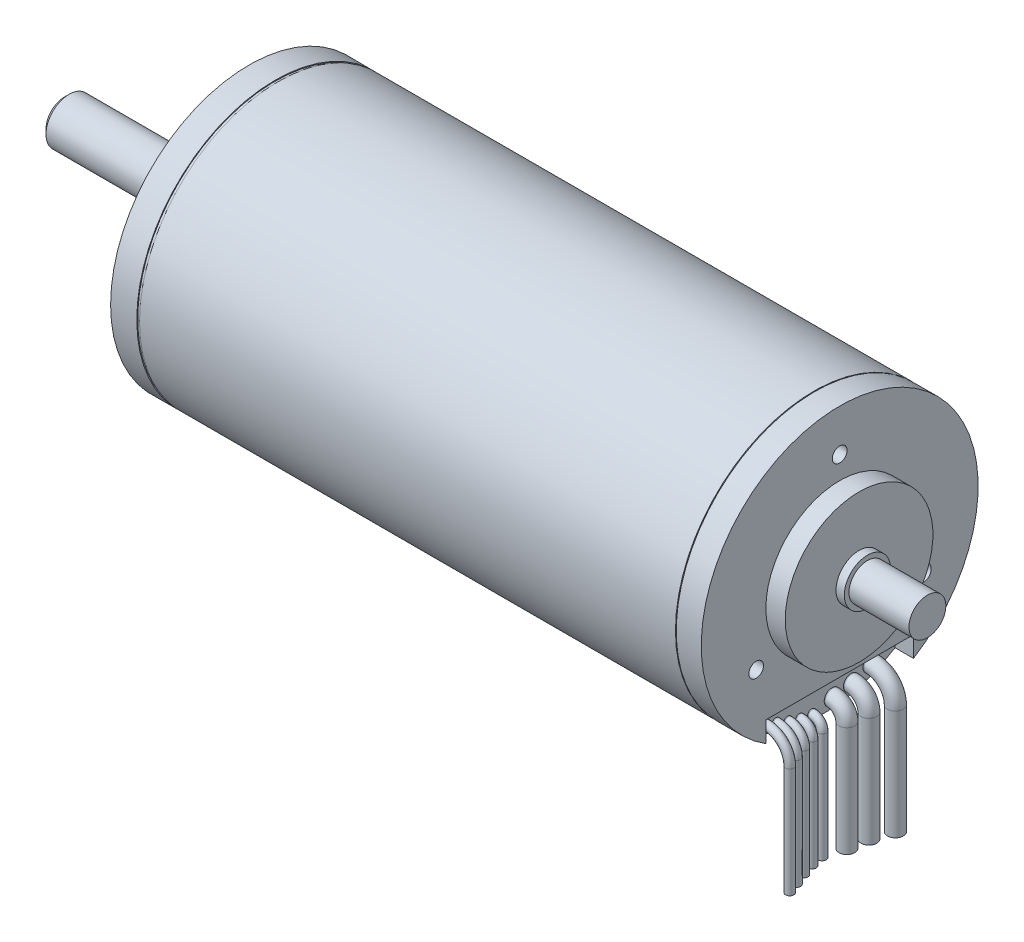
from build123d import *

# Parameters (mm, degrees)
SKETCH_2_R          = 1.5
CUT_EXTRUDE_1_DEPTH = 4.5
SKETCH_3_R          = 0.8
SKETCH_3_R_2        = 0.87
CUT_EXTRUDE_2_DEPTH = 2.4
CUT_EXTRUDE_START   = -2
CUT_EXTRUDE_3_DEPTH = 2
SKETCH_5_R          = 0.848918058
SKETCH_5_R_2        = 0.45
SKETCH_5_R_3        = 0.844950089
SKETCH_5_R_4        = 0.85
CUT_EXTRUDE_START_2 = -5
SKETCH_7_R          = 2
CUT_EXTRUDE_4_DEPTH = 5
SKETCH_8_W          = 0.298438665
SKETCH_8_H          = 0.097633954
SKETCH_9_W          = 0.088601238
SKETCH_9_H          = 0.502687411


with BuildPart() as part:
    # Model → 旋转1 (revolve)
    with BuildSketch(Plane.XY, mode=Mode.PRIVATE) as revolve_1_sk:
        Polygon((20, 7), (18.8, 7), (18.8, 12.5), (0.5, 12.5), (0, 13), (0, 15), (98.5, 15), (98.5, 13), (87, 13), (87, 12.5), (86.1, 12.5), (86.1, 7), (84, 7), (84, 0), (20, 0), align=None)
    revolve(revolve_1_sk.sketch.rotate(Axis((0, 15, 0), (1, 0, 0)), 270), axis=Axis((0, 15, 0), (1, 0, 0)))

    # 草图2 → 切除-拉伸1 (cut)
    with BuildSketch(Plane.ZY.offset(-20)):
        with Locations((0, 26)):
            Circle(SKETCH_2_R)
        with Locations((11, 15)):
            Circle(SKETCH_2_R)
        with Locations((0, 4)):
            Circle(SKETCH_2_R)
        with Locations((-11, 15)):
            Circle(SKETCH_2_R)
    extrude(amount=-CUT_EXTRUDE_1_DEPTH, mode=Mode.SUBTRACT)

    # 草图3 → 切除-拉伸2 (cut)
    with BuildSketch(Plane(origin=(84, 0, 0), x_dir=(0, 0, -1), z_dir=(1, 0, 0))):
        with Locations((0, 25.45)):
            Circle(SKETCH_3_R)
        with Locations((9.04996547, 9.775)):
            Circle(SKETCH_3_R_2)
        with Locations((-9.04996547, 9.775)):
            Circle(SKETCH_3_R)
    extrude(amount=-CUT_EXTRUDE_2_DEPTH, mode=Mode.SUBTRACT)

    # 草图4 → 切除-拉伸3 (cut)
    with BuildSketch(Plane(origin=(84, 0, 0), x_dir=(0, 0, -1), z_dir=(1, 0, 0)).offset(CUT_EXTRUDE_START)):
        with BuildLine():
            Line((0, 4.55), (-8, 4.55))
            Line((-8, 4.55), (-8, 2.31142246))
            ThreePointArc((-8, 2.31142246), (0, 0), (8, 2.31142246))
            Line((8, 2.31142246), (8, 4.55))
            Line((8, 4.55), (0, 4.55))
        make_face()
    extrude(amount=CUT_EXTRUDE_3_DEPTH, mode=Mode.SUBTRACT)

    # 扫描1: sweep along a path in 草图6
    with BuildLine(Plane.XY) as sweep_1_path:
        Line((83.392576521, -12.282126989), (83.392576521, -0.384586773))
        ThreePointArc((83.392576521, -0.384586773), (83.011815336, 0.534652043), (82.092576521, 0.915413227))
        Line((82.092576521, 0.915413227), (82, 0.915413227))
    # 草图5 → 扫描1 (sweep)
    with BuildSketch(Plane(origin=(82, 0, 0), x_dir=(0, 0, -1), z_dir=(1, 0, 0))):
        with Locations((1.173037316, 1.126598722)):
            Circle(SKETCH_5_R)
        with Locations((-6.075437479, 2.186898349)):
            Circle(SKETCH_5_R_2)
        with Locations((3.248517437, 1.442432653)):
            Circle(SKETCH_5_R_3)
        with Locations((5.369116691, 2.186898349)):
            Circle(SKETCH_5_R_4)
        with Locations((-1.037800205, 0.652847824)):
            Circle(SKETCH_5_R_2)
        with Locations((-2.346255063, 0.874404145)):
            Circle(SKETCH_5_R_2)
        with Locations((-3.632150356, 1.261956121)):
            Circle(SKETCH_5_R_2)
        with Locations((-4.918045648, 1.758266585)):
            Circle(SKETCH_5_R_2)
    sweep(path=sweep_1_path.line)

    # 草图7 → 切除-拉伸4 (cut)
    with BuildSketch(Plane(origin=(98.5, 0, 0), x_dir=(0, 0, -1), z_dir=(1, 0, 0)).offset(CUT_EXTRUDE_START_2)):
        with Locations(Location((0, 15, 0), (0, 0, 180))):
            Circle(SKETCH_7_R)
    extrude(amount=CUT_EXTRUDE_4_DEPTH, mode=Mode.SUBTRACT)

    # 草图8 → 切除-旋转1 (revolve, cut)
    with BuildSketch(Plane.XY, mode=Mode.PRIVATE) as cut_revolve_1_sk:
        with Locations((22.985476291, 29.951183023)):
            Rectangle(SKETCH_8_W, SKETCH_8_H)
    revolve(cut_revolve_1_sk.sketch.rotate(Axis((0, 15, 0), (-1, 0, 0)), 212.230952636), axis=Axis((0, 15, 0), (-1, 0, 0)), mode=Mode.SUBTRACT)

    # 草图9 → 切除-旋转2 (revolve, cut)
    with BuildSketch(Plane.XY, mode=Mode.PRIVATE) as cut_revolve_2_sk:
        with Locations((81.246477717, 30.129929678)):
            Rectangle(SKETCH_9_W, SKETCH_9_H)
    revolve(cut_revolve_2_sk.sketch.rotate(Axis((0, 15, 0), (-1, 0, 0)), 90), axis=Axis((0, 15, 0), (-1, 0, 0)), mode=Mode.SUBTRACT)


solid = part.part
